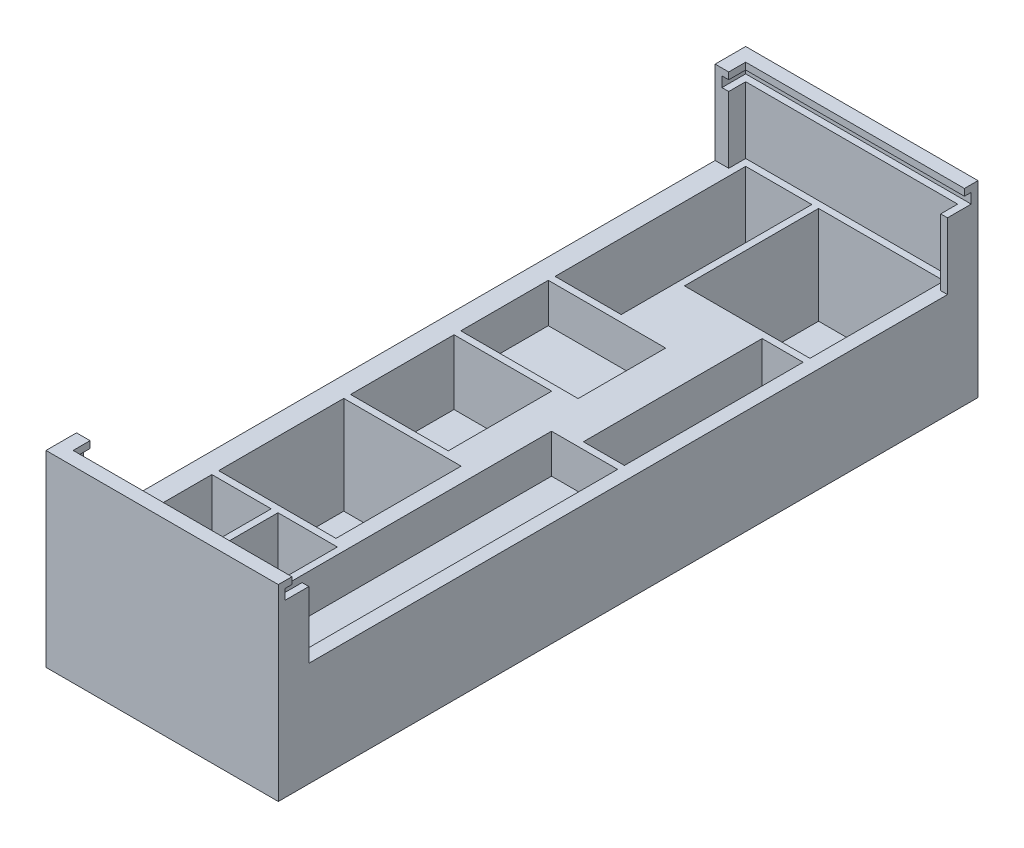
from build123d import *

# Parameters (mm, degrees)
SKETCH1_4_W          = 19.5
SKETCH1_4_H          = 56.2
BOSS_EXTRUDE3_DEPTH  = 2
SKETCH1_5_W          = 12.1
SKETCH1_5_H          = 52.7
BOSS_EXTRUDE4_DEPTH  = 13.8
BOSS_EXTRUDE5_DEPTH  = 17.3
SKETCH1_8_W          = 34.6
SKETCH1_8_H          = 25.8
BOSS_EXTRUDE7_DEPTH  = 17.2
SKETCH1_9_W          = 28.8
SKETCH1_9_H          = 30.5
BOSS_EXTRUDE8_DEPTH  = 9.7
SKETCH1_10_W         = 17.5
SKETCH1_10_H         = 36.9
SKETCH1_10_W_2       = 34.6
SKETCH1_10_W_3       = 28.8
SKETCH1_10_H_2       = 30.5
SKETCH1_10_H_3       = 25.8
SKETCH1_10_W_4       = 19.5
SKETCH1_10_H_4       = 56.2
SKETCH1_10_W_5       = 12.1
SKETCH1_10_H_5       = 52.7
SKETCH1_10_W_6       = 37
SKETCH1_10_H_6       = 39.55
BOSS_EXTRUDE9_DEPTH  = 28.791978309
BOSS_EXTRUDE10_DEPTH = 48.4
BOSS_EXTRUDE11_DEPTH = 53.4
BOSS_EXTRUDE12_DEPTH = 2
SKETCH1_13_W         = 68.5
SKETCH1_13_H         = 206.3
BOSS_EXTRUDE13_DEPTH = 2


with BuildPart() as part:
    # Sketch1<4> → Boss-Extrude3 (new body)
    with BuildSketch(Plane(origin=(0, 0, 0), x_dir=(1, 0, 0), z_dir=(0, 1, 0))):
        with Locations((-18.5, 69.05)):
            Rectangle(SKETCH1_4_W, SKETCH1_4_H)
    extrude(amount=BOSS_EXTRUDE3_DEPTH)



with BuildPart() as body_2:
    # Sketch1<5> → Boss-Extrude4 (new body)
    with BuildSketch(Plane(origin=(0, 0, 0), x_dir=(1, 0, 0), z_dir=(0, 1, 0))):
        with Locations((24.2, 29.25)):
            Rectangle(SKETCH1_5_W, SKETCH1_5_H)
    extrude(amount=BOSS_EXTRUDE4_DEPTH)


with BuildPart() as body_3:
    # Sketch1 → Boss-Extrude5 (new body)
    with BuildSketch(Plane(origin=(0, 0, 0), x_dir=(1, 0, 0), z_dir=(0, 1, 0))):
        Polygon((10.75, 0.9), (10.75, -90.4), (29.25, -90.4), (30.25, -90.4), (30.25, 0.9), align=None)
    extrude(amount=BOSS_EXTRUDE5_DEPTH)


with BuildPart() as body_4:
    # Sketch1<8> → Boss-Extrude7 (new body)
    with BuildSketch(Plane(origin=(0, 0, 0), x_dir=(1, 0, 0), z_dir=(0, 1, 0))):
        with Locations((-10.95, 26.05)):
            Rectangle(SKETCH1_8_W, SKETCH1_8_H)
    extrude(amount=BOSS_EXTRUDE7_DEPTH)


with BuildPart() as body_5:
    # Sketch1<9> → Boss-Extrude8 (new body)
    with BuildSketch(Plane(origin=(0, 0, 0), x_dir=(1, 0, 0), z_dir=(0, 1, 0))):
        with Locations((-13.85, -4.1)):
            Rectangle(SKETCH1_9_W, SKETCH1_9_H)
    extrude(amount=BOSS_EXTRUDE8_DEPTH)


with BuildPart() as part_1:
    add(part.part)

    add(body_2.part)  # Boss-Extrude9 merges body 2

    add(body_3.part)  # Boss-Extrude9 merges body 3

    add(body_4.part)  # Boss-Extrude9 merges body 4

    add(body_5.part)  # Boss-Extrude9 merges body 5
    # Sketch1<10> → Boss-Extrude9 (add)
    with BuildSketch(Plane(origin=(0, 0, 0), x_dir=(1, 0, 0), z_dir=(0, 1, 0))):
        Polygon((34.25, -94.15), (34.25, 94.15), (32.25, 94.15), (32.25, 99.15), (-30.25, 99.15), (-30.25, 94.15), (-34.25, 94.15), (-34.25, -94.15), (-30.25, -94.15), (-30.25, -99.15), (32.25, -99.15), (32.25, -94.15), align=None)
        with Locations((-19.5, -78.7)):
            Rectangle(SKETCH1_10_W, SKETCH1_10_H, mode=Mode.SUBTRACT)
        with Locations((-10.95, -39.8)):
            Rectangle(SKETCH1_10_W_2, SKETCH1_10_H, mode=Mode.SUBTRACT)
        with Locations((-13.85, -4.1)):
            Rectangle(SKETCH1_10_W_3, SKETCH1_10_H_2, mode=Mode.SUBTRACT)
        with Locations((0, -78.7)):
            Rectangle(SKETCH1_10_W, SKETCH1_10_H, mode=Mode.SUBTRACT)
        Polygon((29.25, -90.4), (10.75, -90.4), (10.75, 0.9), (30.25, 0.9), (30.25, -90.4), align=None, mode=Mode.SUBTRACT)
        with Locations((-10.95, 26.05)):
            Rectangle(SKETCH1_10_W_2, SKETCH1_10_H_3, mode=Mode.SUBTRACT)
        with Locations((-18.5, 69.05)):
            Rectangle(SKETCH1_10_W_4, SKETCH1_10_H_4, mode=Mode.SUBTRACT)
        with Locations((24.2, 29.25)):
            Rectangle(SKETCH1_10_W_5, SKETCH1_10_H_5, mode=Mode.SUBTRACT)
        with Locations((11.75, 77.375)):
            Rectangle(SKETCH1_10_W_6, SKETCH1_10_H_6, mode=Mode.SUBTRACT)
    extrude(amount=BOSS_EXTRUDE9_DEPTH)

    # Sketch1<11> → Boss-Extrude10 (add)
    with BuildSketch(Plane(origin=(0, 0, 0), x_dir=(1, 0, 0), z_dir=(0, 1, 0))):
        Polygon((34.25, 94.15), (34.25, 101.15), (-32.25, 101.15), (-32.25, 94.15), (-30.25, 94.15), (-30.25, 99.15), (32.25, 99.15), (32.25, 94.15), align=None)
        Polygon((34.25, -101.15), (34.25, -94.15), (32.25, -94.15), (32.25, -99.15), (-30.25, -99.15), (-30.25, -94.15), (-32.25, -94.15), (-32.25, -101.15), align=None)
    extrude(amount=BOSS_EXTRUDE10_DEPTH)

    # Sketch1<12> → Boss-Extrude11 (add)
    with BuildSketch(Plane(origin=(0, 0, 0), x_dir=(1, 0, 0), z_dir=(0, 1, 0))):
        Polygon((-32.25, 101.15), (34.25, 101.15), (34.25, 103.15), (-34.25, 103.15), (-34.25, 94.15), (-32.25, 94.15), align=None)
        Polygon((-32.25, -101.15), (-32.25, -94.15), (-34.25, -94.15), (-34.25, -103.15), (34.25, -103.15), (34.25, -101.15), align=None)
    extrude(amount=BOSS_EXTRUDE11_DEPTH)

    # Sketch2 → Boss-Extrude12 (add)
    with BuildSketch(Plane(origin=(0, 53.4, 0), x_dir=(1, 0, 0), z_dir=(0, 1, 0))):
        Polygon((-32.25, -94.15), (-32.25, -101.15), (34.25, -101.15), (34.25, -99.15), (-30.25, -99.15), (-30.25, -94.15), align=None)
        Polygon((-32.25, 94.15), (-32.25, 101.15), (34.25, 101.15), (34.25, 99.15), (-30.25, 99.15), (-30.25, 94.15), align=None)
    extrude(amount=-BOSS_EXTRUDE12_DEPTH)

    # Sketch1<13> → Boss-Extrude13 (add)
    with BuildSketch(Plane(origin=(0, 0, 0), x_dir=(1, 0, 0), z_dir=(0, 1, 0))):
        Rectangle(SKETCH1_13_W, SKETCH1_13_H)
    extrude(amount=-BOSS_EXTRUDE13_DEPTH)


solid = part_1.part
